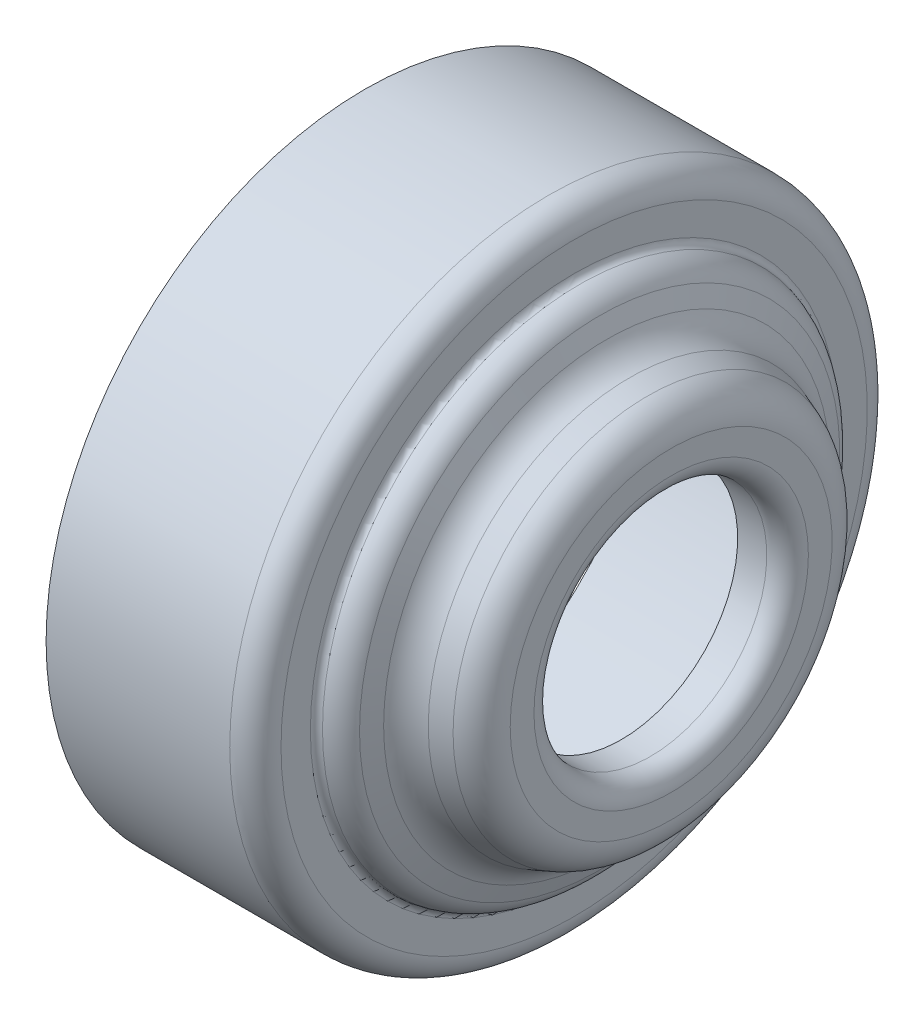
from build123d import *


with BuildPart() as part:
    # 草图1 → 旋转1 (revolve)
    with BuildSketch(Plane.XY, mode=Mode.PRIVATE) as revolve_1_sk:
        with BuildLine():
            Line((-14.5, 22), (-1.25, 22))
            ThreePointArc((-1.25, 22), (-0.648959236, 21.751040764), (-0.4, 21.15))
            Line((-0.4, 21.15), (-0.4, 18.1))
            ThreePointArc((-0.4, 18.1), (-0.253553391, 17.746446609), (0.1, 17.6))
            Line((0.1, 17.6), (0.510905763, 17.6))
            ThreePointArc((0.510905763, 17.6), (1.116445873, 17.418325201), (1.521965296, 16.933311228))
            Line((1.521965296, 16.933311228), (2.043623907, 15.716107803))
            ThreePointArc((2.043623907, 15.716107803), (2.934895151, 14.431821006), (4.258908102, 13.600709274))
            Line((4.258908102, 13.600709274), (5.561797507, 13.112125748))
            ThreePointArc((5.561797507, 13.112125748), (6.315080988, 12.525350804), (6.6, 11.613999064))
            Line((6.6, 11.613999064), (6.6, 9.9))
            ThreePointArc((6.6, 9.9), (6.453553391, 9.546446609), (6.1, 9.4))
            Line((6.1, 9.4), (4, 9.4))
            Line((4, 9.4), (4, 8.4))
            Line((4, 8.4), (6.1, 8.4))
            ThreePointArc((6.1, 8.4), (7.160660172, 8.839339828), (7.6, 9.9))
            Line((7.6, 9.9), (7.6, 11.613999064))
            ThreePointArc((7.6, 11.613999064), (7.137006606, 13.094945642), (5.912920948, 14.048454925))
            Line((5.912920948, 14.048454925), (4.610031544, 14.537038452))
            ThreePointArc((4.610031544, 14.537038452), (3.625509093, 15.155044612), (2.962768937, 16.110027101))
            Line((2.962768937, 16.110027101), (2.441110326, 17.327230527))
            ThreePointArc((2.441110326, 17.327230527), (1.859311875, 18.109907127), (0.986712647, 18.545386958))
            ThreePointArc((0.986712647, 18.545386958), (0.708436674, 18.721452733), (0.6, 19.032383853))
            Line((0.6, 19.032383853), (0.6, 21.15))
            ThreePointArc((0.6, 21.15), (0.058147545, 22.458147545), (-1.25, 23))
            Line((-1.25, 23), (-14.5, 23))
            Line((-14.5, 23), (-14.5, 22))
        make_face()
    revolve(revolve_1_sk.sketch.rotate(Axis((-28.972485425, 0, 0), (1, 0, 0)), 90), axis=Axis((-28.972485425, 0, 0), (1, 0, 0)))


solid = part.part
